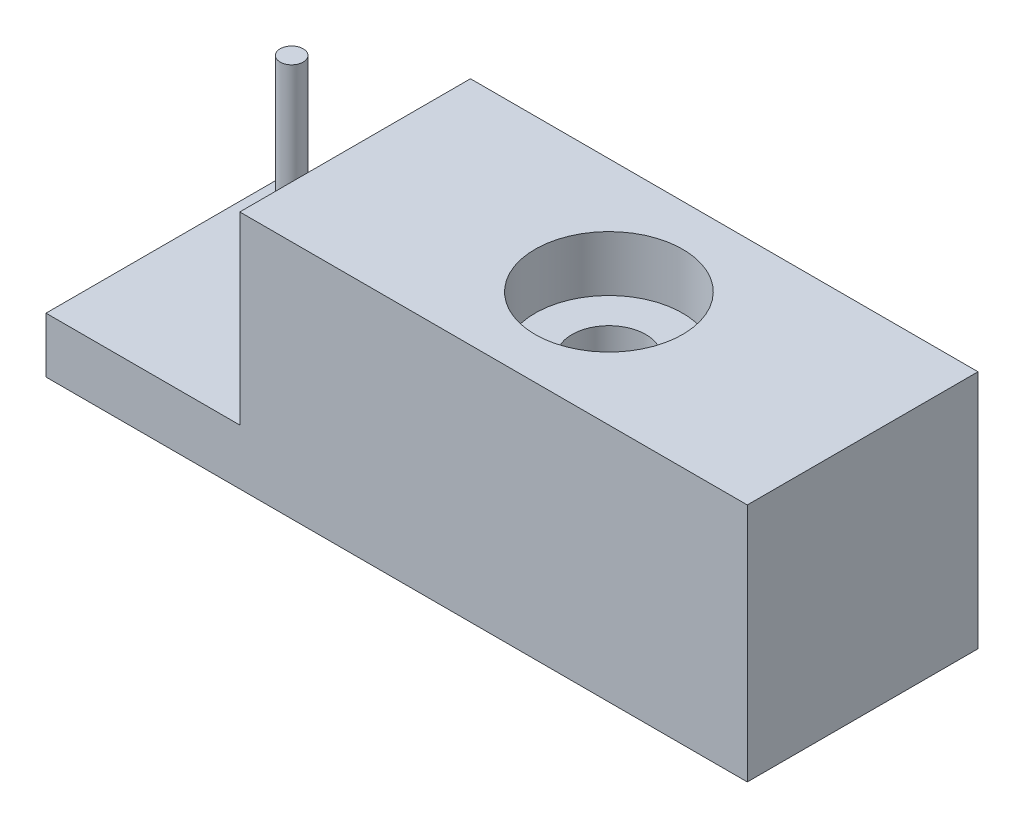
from build123d import *

# Parameters (mm, degrees)
SKETCH1_W                = 152
SKETCH1_H                = 52
BOSS_EXTRUDE1_DEPTH      = 50
SKETCH2_W                = 42
SKETCH2_H                = 40
CUT_EXTRUDE1_DEPTH       = 169.249814264
SKETCH3_R                = 16
CUT_EXTRUDE2_DEPTH       = 12
SKETCH4_R                = 8
CUT_EXTRUDE3_DEPTH       = 165.93635136
BOSS_EXTRUDE2_DEPTH      = 10
BOSS_EXTRUDE2_DEPTH_BACK = 40
SKETCH6_R                = 2.5


with BuildPart() as part:
    # Sketch1 → Boss-Extrude1 (new body)
    with BuildSketch(Plane.XY):
        with Locations((76, 26)):
            Rectangle(SKETCH1_W, SKETCH1_H)
    extrude(amount=-BOSS_EXTRUDE1_DEPTH)

    # Sketch2 → Cut-Extrude1 (cut, through all)
    with BuildSketch(Plane.XY):
        with Locations((21, 32)):
            Rectangle(SKETCH2_W, SKETCH2_H)
    extrude(amount=-CUT_EXTRUDE1_DEPTH, mode=Mode.SUBTRACT)

    # Sketch3 → Cut-Extrude2 (cut)
    with BuildSketch(Plane(origin=(0, 52, 0), x_dir=(1, 0, 0), z_dir=(0, 1, 0))):
        with Locations(Location((97, 25, 0), (0, 0, 270))):
            Circle(SKETCH3_R)
    cut_extrude2 = extrude(amount=-CUT_EXTRUDE2_DEPTH, mode=Mode.SUBTRACT)

    # Mirror1: Cut-Extrude2 across plane
    add(cut_extrude2.mirror(Plane.ZX.offset(26)), mode=Mode.SUBTRACT)

    # Sketch4 → Cut-Extrude3 (cut, through all)
    with BuildSketch(Plane(origin=(0, 40, 0), x_dir=(1, 0, 0), z_dir=(0, 1, 0))):
        with Locations(Location((97, 25, 0), (0, 0, 270))):
            Circle(SKETCH4_R)
    extrude(amount=-CUT_EXTRUDE3_DEPTH, mode=Mode.SUBTRACT)

    # Sketch6 → Boss-Extrude2 (add, two sides: drawn at the far end of the back side and taken through both)
    with BuildSketch(Plane(origin=(0, 52, 0), x_dir=(1, 0, 0), z_dir=(0, 1, 0)).offset(-BOSS_EXTRUDE2_DEPTH_BACK)):
        with Locations(Location((28.25, 25, 0), (0, 0, 90))):
            Circle(SKETCH6_R)
    extrude(amount=BOSS_EXTRUDE2_DEPTH + BOSS_EXTRUDE2_DEPTH_BACK)


solid = part.part
